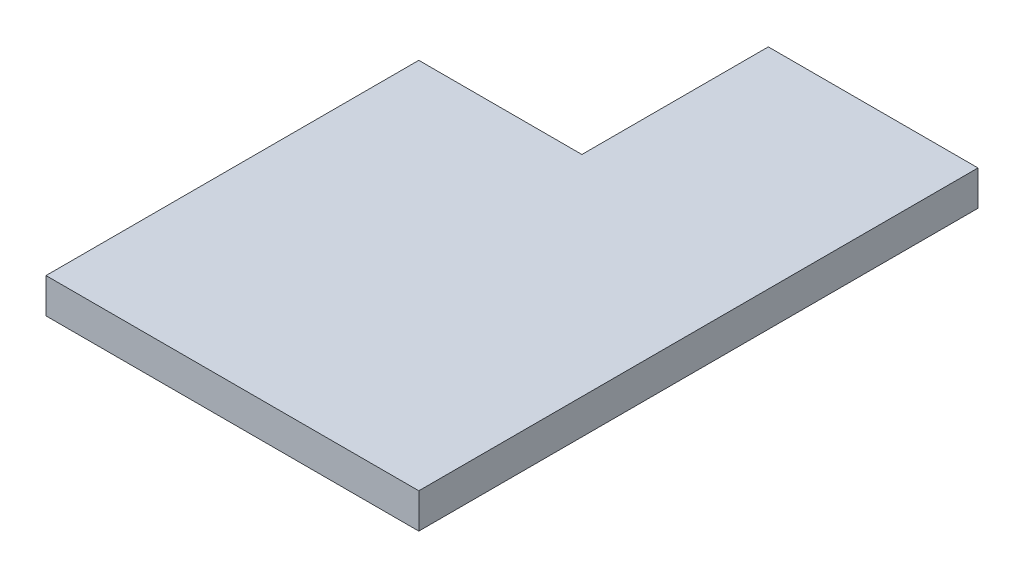
from build123d import *

# Parameters (mm, degrees)
BOSS_EXTRUDE1_DEPTH = 19.05


with BuildPart() as part:
    # Sketch1 → Boss-Extrude1 (new body)
    with BuildSketch(Plane(origin=(0, 0, 0), x_dir=(1, 0, 0), z_dir=(0, 1, 0))):
        Polygon((0, 0), (203.2, 0), (203.2, 304.8), (88.9, 304.8), (88.9, 203.2), (0, 203.2), align=None)
    extrude(amount=BOSS_EXTRUDE1_DEPTH)


solid = part.part
